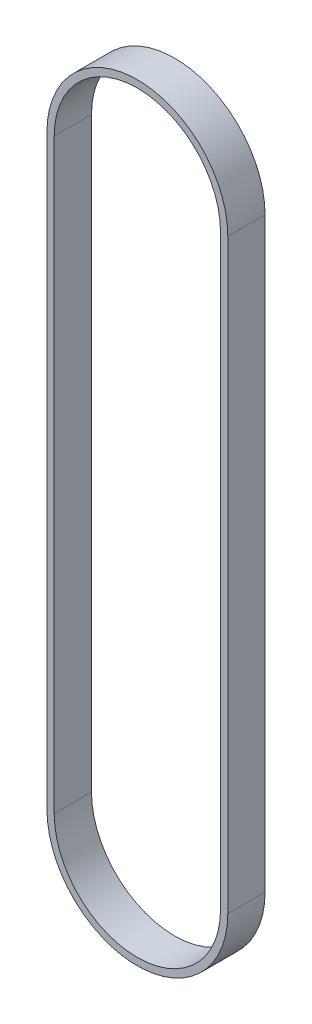
from build123d import *

# Parameters (mm, degrees)
EXTRUDE_5_DEPTH = 9.529


with BuildPart() as part:
    # 草图1 → 凸台-拉伸5 (new body)
    with BuildSketch(Plane.XY):
        with BuildLine():
            Line((-23.12, 0), (-23.12, -150))
            ThreePointArc((-23.12, -150), (0, -173.12), (23.12, -150))
            Line((23.12, -150), (23.12, 0))
            ThreePointArc((23.12, 0), (0, 23.12), (-23.12, 0))
        make_face()
        with BuildLine():
            Line((-21.265, 0), (-21.265, -150))
            ThreePointArc((-21.265, -150), (0, -171.265), (21.265, -150))
            Line((21.265, -150), (21.265, 0))
            ThreePointArc((21.265, 0), (0, 21.265), (-21.265, 0))
        make_face(mode=Mode.SUBTRACT)
    extrude(amount=EXTRUDE_5_DEPTH)


solid = part.part
